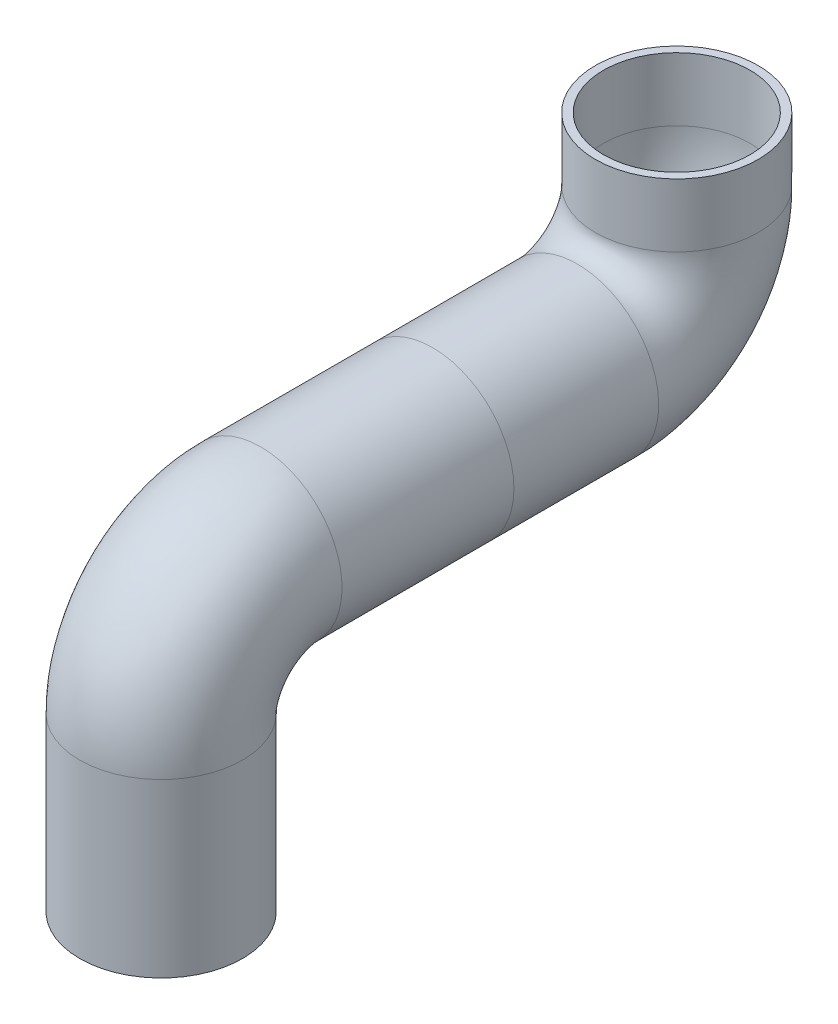
from build123d import *

# Parameters (mm, degrees)
SKETCH2_R   = 150
SKETCH2_R_2 = 135


with BuildPart() as part:
    # Sweep2: sweep along a path in Sketch1
    with BuildLine(Plane(origin=(0, 0, 0), x_dir=(0, 0, -1), z_dir=(1, 0, 0))) as sweep2_path:
        Line((0, 0), (0, 316.67))
        ThreePointArc((0, 316.67), (53.696113805, 446.303886195), (183.33, 500))
        Line((183.33, 500), (500, 500))
        Line((500, 500), (766.67, 500))
        ThreePointArc((766.67, 500), (896.303886195, 553.696113805), (950, 683.33))
        Line((950, 683.33), (950, 800))
    # Sketch2 → Sweep2 (sweep)
    with BuildSketch(Plane(origin=(0, 0, 0), x_dir=(1, 0, 0), z_dir=(0, 1, 0))):
        Circle(SKETCH2_R)
        Circle(SKETCH2_R_2, mode=Mode.SUBTRACT)
    sweep(path=sweep2_path.line)


solid = part.part
